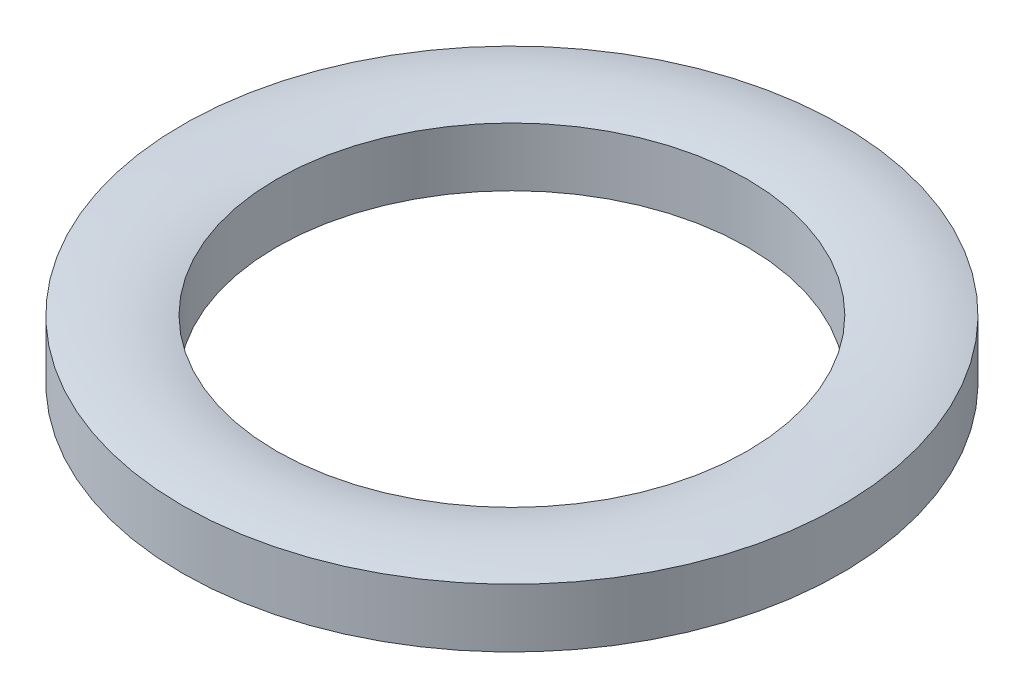
from build123d import *


with BuildPart() as part:
    # Sketch1 → Base-Revolve (revolve)
    with BuildSketch(Plane.XY, mode=Mode.PRIVATE) as base_revolve_sk:
        with BuildLine():
            Line((5, 0.127016654), (5, 1.372983346))
            ThreePointArc((5, 1.372983346), (6, 1.5), (7, 1.372983346))
            Line((7, 1.372983346), (7, 0.127016654))
            ThreePointArc((7, 0.127016654), (6, 0), (5, 0.127016654))
        make_face()
    revolve(base_revolve_sk.sketch.rotate(Axis((0, 10.216088328, 0), (0, -1, 0)), 90), axis=Axis((0, 10.216088328, 0), (0, -1, 0)))


solid = part.part
